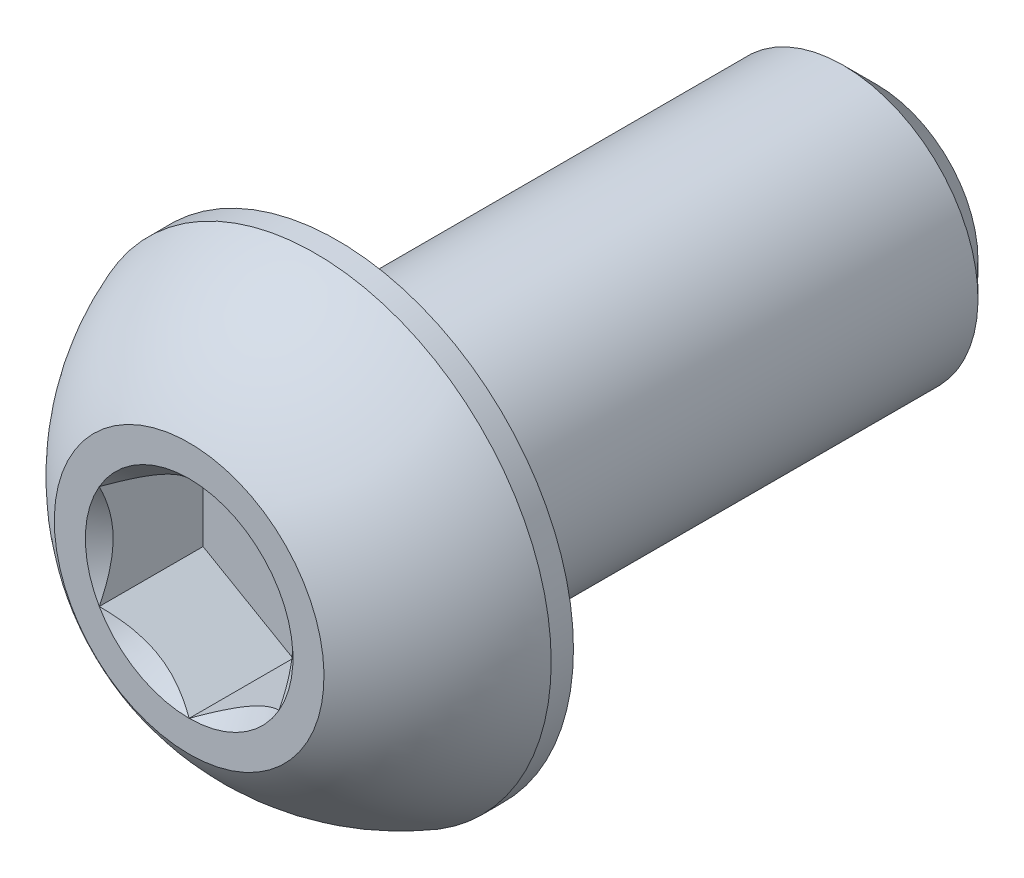
from build123d import *

# Parameters (mm, degrees)
SKETCH1_W          = 12
SKETCH1_H          = 3
CHAMFER1_SIZE      = 0.75
CUT_EXTRUDE2_DEPTH = 2.31


with BuildPart() as part:
    # Sketch1 → Revolve1 (revolve)
    with BuildSketch(Plane(origin=(0, 0, 0), x_dir=(0, 0, -1), z_dir=(1, 0, 0))):
        with Locations((9.3, 1.5)):
            Rectangle(SKETCH1_W, SKETCH1_H)
    revolve(axis=Axis((0, 0, -15.3), (0, 0, 1)))

    # Chamfer1
    chamfer1_edges = [part.edges().sort_by_distance(p)[0] for p in [
        (0, -3, -15.3),
    ]]
    chamfer(chamfer1_edges, length=CHAMFER1_SIZE)

    # Sketch7 → Revolve2 (revolve)
    with BuildSketch(Plane(origin=(0, 0, 0), x_dir=(0, 0, -1), z_dir=(1, 0, 0))):
        with BuildLine():
            Line((2.805, 5.25), (3.3, 5.25))
            Line((3.3, 5.25), (3.3, 0))
            Line((3.3, 0), (0, 0))
            Line((0, 0), (0, 3))
            ThreePointArc((0, 3), (1.216479019, 4.356906156), (2.805, 5.25))
        make_face()
    revolve(axis=Axis((0, 0, 0), (0, 0, -1)))

    # Sketch5 → Cut-Extrude2 (cut)
    with BuildSketch(Plane.XY):
        Polygon((2, -1.154700538), (2, 1.154700538), (0, 2.309401077), (-2, 1.154700538), (-2, -1.154700538), (0, -2.309401077), align=None)
    extrude(amount=-CUT_EXTRUDE2_DEPTH, mode=Mode.SUBTRACT)

    # Cut-Extrude3 cone 1 section (through the dimple's axis) → Cut-Extrude3 (revolve, cut)
    with BuildSketch(Plane(origin=(0, 0, 0), x_dir=(0, -1, 0), z_dir=(1, 0, 0))):
        Polygon((0, 0), (2.309401077, 0), (0, 2.309401077), align=None)
    revolve(axis=Axis((0, 0, 0), (0, 0, -1)), mode=Mode.SUBTRACT)


solid = part.part
